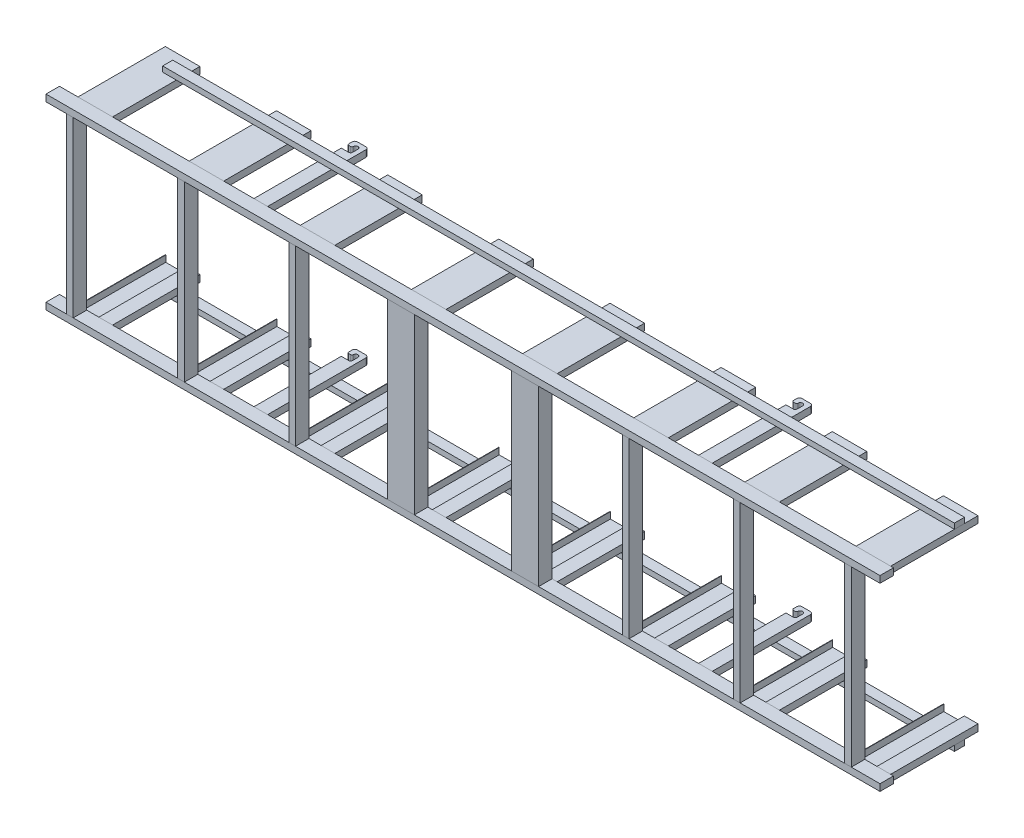
from build123d import *

# Parameters (mm, degrees)
SKETCH1_W              = 6190
SKETCH1_H              = 50
BOSS_EXTRUDE1_DEPTH    = 100
BOSS_EXTRUDE1_2_DEPTH  = 100
SKETCH2_W              = 200
SKETCH2_H              = 100
BOSS_EXTRUDE2_DEPTH    = 1388
BOSS_EXTRUDE2_2_DEPTH  = 1388
BOSS_EXTRUDE3_REACH    = 6335.746
SKETCH4_W              = 50
SKETCH4_H              = 100
BOSS_EXTRUDE4_DEPTH    = 648.4
BOSS_EXTRUDE4_2_DEPTH  = 648.4
BOSS_EXTRUDE4_3_DEPTH  = 648.4
BOSS_EXTRUDE4_4_DEPTH  = 648.4
BOSS_EXTRUDE4_5_DEPTH  = 648.4
BOSS_EXTRUDE4_6_DEPTH  = 648.4
BOSS_EXTRUDE4_7_DEPTH  = 648.4
BOSS_EXTRUDE4_8_DEPTH  = 648.4
BOSS_EXTRUDE4_9_DEPTH  = 648.4
BOSS_EXTRUDE4_10_DEPTH = 648.4
BOSS_EXTRUDE4_11_DEPTH = 648.4
BOSS_EXTRUDE4_12_DEPTH = 648.4
BOSS_EXTRUDE4_13_DEPTH = 648.4
BOSS_EXTRUDE4_14_DEPTH = 648.4
BOSS_EXTRUDE4_15_DEPTH = 648.4
BOSS_EXTRUDE4_16_DEPTH = 648.4
BOSS_EXTRUDE5_DEPTH    = 50
BOSS_EXTRUDE5_2_DEPTH  = 50
BOSS_EXTRUDE6_DEPTH    = 50
BOSS_EXTRUDE6_2_DEPTH  = 50
SKETCH10_W             = 75
SKETCH10_H             = 40
BOSS_EXTRUDE7_DEPTH    = 5876.6
BOSS_EXTRUDE7_2_DEPTH  = 5876.6


with BuildPart() as part:
    # Sketch1 → Boss-Extrude1 (new body)
    with BuildSketch(Plane.XY):
        with Locations((3095, 1363)):
            Rectangle(SKETCH1_W, SKETCH1_H)
    extrude(amount=BOSS_EXTRUDE1_DEPTH)


with BuildPart() as body_2:
    # Sketch1 → Boss-Extrude1 2 (new body)
    with BuildSketch(Plane.XY):
        with Locations((3095, 25)):
            Rectangle(SKETCH1_W, SKETCH1_H)
    extrude(amount=BOSS_EXTRUDE1_2_DEPTH)


with BuildPart() as body_3:
    # Sketch2 → Boss-Extrude2 (new body)
    with BuildSketch(Plane.XZ):
        with Locations((2634, 50)):
            Rectangle(SKETCH2_W, SKETCH2_H)
    extrude(amount=-BOSS_EXTRUDE2_DEPTH)


with BuildPart() as body_4:
    # Sketch2 → Boss-Extrude2 2 (new body)
    with BuildSketch(Plane.XZ):
        with Locations((3556, 50)):
            Rectangle(SKETCH2_W, SKETCH2_H)
    extrude(amount=-BOSS_EXTRUDE2_2_DEPTH)


with BuildPart() as body_5:

    # Sketch4 → Boss-Extrude3 (new, up to next)
    with BuildSketch(Plane(origin=(0, 50, 0), x_dir=(1, 0, 0), z_dir=(0, 1, 0)), mode=Mode.PRIVATE) as boss_extrude3_sk1:
        with Locations((177, -50)):
            Rectangle(SKETCH4_W, SKETCH4_H)
    boss_extrude3_tool1 = extrude(boss_extrude3_sk1.sketch, amount=BOSS_EXTRUDE3_REACH, mode=Mode.PRIVATE) - part.part
    # Sketch4 → Boss-Extrude3 (new, up to next)
    with BuildSketch(Plane(origin=(0, 50, 0), x_dir=(1, 0, 0), z_dir=(0, 1, 0)), mode=Mode.PRIVATE) as boss_extrude3_sk2:
        with Locations((1002, -50)):
            Rectangle(SKETCH4_W, SKETCH4_H)
    boss_extrude3_tool2 = extrude(boss_extrude3_sk2.sketch, amount=BOSS_EXTRUDE3_REACH, mode=Mode.PRIVATE) - part.part
    # Sketch4 → Boss-Extrude3 (new, up to next)
    with BuildSketch(Plane(origin=(0, 50, 0), x_dir=(1, 0, 0), z_dir=(0, 1, 0)), mode=Mode.PRIVATE) as boss_extrude3_sk3:
        with Locations((1827, -50)):
            Rectangle(SKETCH4_W, SKETCH4_H)
    boss_extrude3_tool3 = extrude(boss_extrude3_sk3.sketch, amount=BOSS_EXTRUDE3_REACH, mode=Mode.PRIVATE) - part.part
    # Sketch4 → Boss-Extrude3 (new, up to next)
    with BuildSketch(Plane(origin=(0, 50, 0), x_dir=(1, 0, 0), z_dir=(0, 1, 0)), mode=Mode.PRIVATE) as boss_extrude3_sk4:
        with Locations((4302, -50)):
            Rectangle(SKETCH4_W, SKETCH4_H)
    boss_extrude3_tool4 = extrude(boss_extrude3_sk4.sketch, amount=BOSS_EXTRUDE3_REACH, mode=Mode.PRIVATE) - part.part
    # Sketch4 → Boss-Extrude3 (new, up to next)
    with BuildSketch(Plane(origin=(0, 50, 0), x_dir=(1, 0, 0), z_dir=(0, 1, 0)), mode=Mode.PRIVATE) as boss_extrude3_sk5:
        with Locations((5127, -50)):
            Rectangle(SKETCH4_W, SKETCH4_H)
    boss_extrude3_tool5 = extrude(boss_extrude3_sk5.sketch, amount=BOSS_EXTRUDE3_REACH, mode=Mode.PRIVATE) - part.part
    # Sketch4 → Boss-Extrude3 (new, up to next)
    with BuildSketch(Plane(origin=(0, 50, 0), x_dir=(1, 0, 0), z_dir=(0, 1, 0)), mode=Mode.PRIVATE) as boss_extrude3_sk6:
        with Locations((5952, -50)):
            Rectangle(SKETCH4_W, SKETCH4_H)
    boss_extrude3_tool6 = extrude(boss_extrude3_sk6.sketch, amount=BOSS_EXTRUDE3_REACH, mode=Mode.PRIVATE) - part.part
    add(boss_extrude3_tool1.solids().sort_by_distance((177, 50, 50))[0])
    add(boss_extrude3_tool2.solids().sort_by_distance((1002, 50, 50))[0])
    add(boss_extrude3_tool3.solids().sort_by_distance((1827, 50, 50))[0])
    add(boss_extrude3_tool4.solids().sort_by_distance((4302, 50, 50))[0])
    add(boss_extrude3_tool5.solids().sort_by_distance((5127, 50, 50))[0])
    add(boss_extrude3_tool6.solids().sort_by_distance((5952, 50, 50))[0])


with BuildPart() as body_6:
    # Sketch5 → Boss-Extrude4 (new body)
    with BuildSketch(Plane.XY):
        Polygon((137.4, 1388), (137.4, 1338), (140.4, 1338), (140.4, 1385.8), (292.4, 1385.8), (292.4, 1338), (394, 1338), (394, 1388), align=None)
    extrude(amount=-BOSS_EXTRUDE4_DEPTH)


with BuildPart() as body_7:
    # Sketch5 → Boss-Extrude4 2 (new body)
    with BuildSketch(Plane.XY):
        Polygon((962.4, 1388), (962.4, 1338), (965.4, 1338), (965.4, 1385.8), (1117.4, 1385.8), (1117.4, 1338), (1219, 1338), (1219, 1388), align=None)
    extrude(amount=-BOSS_EXTRUDE4_2_DEPTH)


with BuildPart() as body_8:
    # Sketch5 → Boss-Extrude4 3 (new body)
    with BuildSketch(Plane.XY):
        Polygon((1787.4, 1388), (1787.4, 1338), (1790.4, 1338), (1790.4, 1385.8), (1942.4, 1385.8), (1942.4, 1338), (2044, 1338), (2044, 1388), align=None)
    extrude(amount=-BOSS_EXTRUDE4_3_DEPTH)


with BuildPart() as body_9:
    # Sketch5 → Boss-Extrude4 4 (new body)
    with BuildSketch(Plane.XY):
        Polygon((2612.4, 1388), (2612.4, 1338), (2615.4, 1338), (2615.4, 1385.8), (2767.4, 1385.8), (2767.4, 1338), (2869, 1338), (2869, 1388), align=None)
    extrude(amount=-BOSS_EXTRUDE4_4_DEPTH)


with BuildPart() as body_10:
    # Sketch5 → Boss-Extrude4 5 (new body)
    with BuildSketch(Plane.XY):
        Polygon((3437.4, 1388), (3437.4, 1338), (3440.4, 1338), (3440.4, 1385.8), (3592.4, 1385.8), (3592.4, 1338), (3694, 1338), (3694, 1388), align=None)
    extrude(amount=-BOSS_EXTRUDE4_5_DEPTH)


with BuildPart() as body_11:
    # Sketch5 → Boss-Extrude4 6 (new body)
    with BuildSketch(Plane.XY):
        Polygon((4262.4, 1388), (4262.4, 1338), (4265.4, 1338), (4265.4, 1385.8), (4417.4, 1385.8), (4417.4, 1338), (4519, 1338), (4519, 1388), align=None)
    extrude(amount=-BOSS_EXTRUDE4_6_DEPTH)


with BuildPart() as body_12:
    # Sketch5 → Boss-Extrude4 7 (new body)
    with BuildSketch(Plane.XY):
        Polygon((5087.4, 1388), (5087.4, 1338), (5090.4, 1338), (5090.4, 1385.8), (5242.4, 1385.8), (5242.4, 1338), (5344, 1338), (5344, 1388), align=None)
    extrude(amount=-BOSS_EXTRUDE4_7_DEPTH)


with BuildPart() as body_13:
    # Sketch5 → Boss-Extrude4 8 (new body)
    with BuildSketch(Plane.XY):
        Polygon((5912.4, 1388), (5912.4, 1338), (5915.4, 1338), (5915.4, 1385.8), (6067.4, 1385.8), (6067.4, 1338), (6169, 1338), (6169, 1388), align=None)
    extrude(amount=-BOSS_EXTRUDE4_8_DEPTH)


with BuildPart() as body_14:
    # Sketch5 → Boss-Extrude4 9 (new body)
    with BuildSketch(Plane.XY):
        Polygon((6067.4, 2.2), (6067.4, 50), (6169, 50), (6169, 0), (5912.4, 0), (5912.4, 50), (5915.4, 50), (5915.4, 2.2), align=None)
    extrude(amount=-BOSS_EXTRUDE4_9_DEPTH)


with BuildPart() as body_15:
    # Sketch5 → Boss-Extrude4 10 (new body)
    with BuildSketch(Plane.XY):
        Polygon((5242.4, 2.2), (5242.4, 50), (5344, 50), (5344, 0), (5087.4, 0), (5087.4, 50), (5090.4, 50), (5090.4, 2.2), align=None)
    extrude(amount=-BOSS_EXTRUDE4_10_DEPTH)


with BuildPart() as body_16:
    # Sketch5 → Boss-Extrude4 11 (new body)
    with BuildSketch(Plane.XY):
        Polygon((4417.4, 2.2), (4417.4, 50), (4519, 50), (4519, 0), (4262.4, 0), (4262.4, 50), (4265.4, 50), (4265.4, 2.2), align=None)
    extrude(amount=-BOSS_EXTRUDE4_11_DEPTH)


with BuildPart() as body_17:
    # Sketch5 → Boss-Extrude4 12 (new body)
    with BuildSketch(Plane.XY):
        Polygon((3592.4, 2.2), (3592.4, 50), (3694, 50), (3694, 0), (3437.4, 0), (3437.4, 50), (3440.4, 50), (3440.4, 2.2), align=None)
    extrude(amount=-BOSS_EXTRUDE4_12_DEPTH)


with BuildPart() as body_18:
    # Sketch5 → Boss-Extrude4 13 (new body)
    with BuildSketch(Plane.XY):
        Polygon((2767.4, 2.2), (2767.4, 50), (2869, 50), (2869, 0), (2612.4, 0), (2612.4, 50), (2615.4, 50), (2615.4, 2.2), align=None)
    extrude(amount=-BOSS_EXTRUDE4_13_DEPTH)


with BuildPart() as body_19:
    # Sketch5 → Boss-Extrude4 14 (new body)
    with BuildSketch(Plane.XY):
        Polygon((1942.4, 2.2), (1942.4, 50), (2044, 50), (2044, 0), (1787.4, 0), (1787.4, 50), (1790.4, 50), (1790.4, 2.2), align=None)
    extrude(amount=-BOSS_EXTRUDE4_14_DEPTH)


with BuildPart() as body_20:
    # Sketch5 → Boss-Extrude4 15 (new body)
    with BuildSketch(Plane.XY):
        Polygon((1117.4, 2.2), (1117.4, 50), (1219, 50), (1219, 0), (962.4, 0), (962.4, 50), (965.4, 50), (965.4, 2.2), align=None)
    extrude(amount=-BOSS_EXTRUDE4_15_DEPTH)


with BuildPart() as body_21:
    # Sketch5 → Boss-Extrude4 16 (new body)
    with BuildSketch(Plane.XY):
        Polygon((292.4, 2.2), (292.4, 50), (394, 50), (394, 0), (137.4, 0), (137.4, 50), (140.4, 50), (140.4, 2.2), align=None)
    extrude(amount=-BOSS_EXTRUDE4_16_DEPTH)


with BuildPart() as body_22:
    # Sketch8 → Boss-Extrude5 (new body)
    with BuildSketch(Plane(origin=(0, 50, 0), x_dir=(1, 0, 0), z_dir=(0, 1, 0))):
        with BuildLine():
            Line((1443.4, 648.4), (1497.5, 648.4))
            ThreePointArc((1497.5, 648.4), (1508.106601718, 652.793398282), (1512.5, 663.4))
            Line((1512.5, 663.4), (1512.5, 703.4))
            ThreePointArc((1512.5, 703.4), (1495, 720.9), (1477.5, 703.4))
            ThreePointArc((1477.5, 703.4), (1474.571067812, 696.328932188), (1467.5, 693.4))
            Line((1467.5, 693.4), (1453.4, 693.4))
            ThreePointArc((1453.4, 693.4), (1446.328932188, 696.328932188), (1443.4, 703.4))
            Line((1443.4, 703.4), (1443.4, 728.4))
            ThreePointArc((1443.4, 728.4), (1449.257864376, 742.542135624), (1463.4, 748.4))
            Line((1463.4, 748.4), (1525, 748.4))
            ThreePointArc((1525, 748.4), (1539.142135624, 742.542135624), (1545, 728.4))
            Line((1545, 728.4), (1545, 0))
            Line((1545, 0), (1443.4, 0))
            Line((1443.4, 0), (1443.4, 648.4))
        make_face()
    extrude(amount=-BOSS_EXTRUDE5_DEPTH)


with BuildPart() as body_23:
    # Sketch8 → Boss-Extrude5 2 (new body)
    with BuildSketch(Plane(origin=(0, 50, 0), x_dir=(1, 0, 0), z_dir=(0, 1, 0))):
        with BuildLine():
            Line((4845, 0), (4743.4, 0))
            Line((4743.4, 0), (4743.4, 648.4))
            Line((4743.4, 648.4), (4797.5, 648.4))
            ThreePointArc((4797.5, 648.4), (4808.106601718, 652.793398282), (4812.5, 663.4))
            Line((4812.5, 663.4), (4812.5, 703.4))
            ThreePointArc((4812.5, 703.4), (4795, 720.9), (4777.5, 703.4))
            ThreePointArc((4777.5, 703.4), (4774.571067812, 696.328932188), (4767.5, 693.4))
            Line((4767.5, 693.4), (4753.4, 693.4))
            ThreePointArc((4753.4, 693.4), (4746.328932188, 696.328932188), (4743.4, 703.4))
            Line((4743.4, 703.4), (4743.4, 728.4))
            ThreePointArc((4743.4, 728.4), (4749.257864376, 742.542135624), (4763.4, 748.4))
            Line((4763.4, 748.4), (4825, 748.4))
            ThreePointArc((4825, 748.4), (4839.142135624, 742.542135624), (4845, 728.4))
            Line((4845, 728.4), (4845, 0))
        make_face()
    extrude(amount=-BOSS_EXTRUDE5_2_DEPTH)


with BuildPart() as body_24:
    # Sketch9 → Boss-Extrude6 (new body)
    with BuildSketch(Plane(origin=(0, 1388, 0), x_dir=(1, 0, 0), z_dir=(0, 1, 0))):
        with BuildLine():
            Line((1443.4, 648.4), (1497.5, 648.4))
            ThreePointArc((1497.5, 648.4), (1508.106601718, 652.793398282), (1512.5, 663.4))
            Line((1512.5, 663.4), (1512.5, 703.4))
            ThreePointArc((1512.5, 703.4), (1495, 720.9), (1477.5, 703.4))
            ThreePointArc((1477.5, 703.4), (1474.571067812, 696.328932188), (1467.5, 693.4))
            Line((1467.5, 693.4), (1453.4, 693.4))
            ThreePointArc((1453.4, 693.4), (1446.328932188, 696.328932188), (1443.4, 703.4))
            Line((1443.4, 703.4), (1443.4, 728.4))
            ThreePointArc((1443.4, 728.4), (1449.257864376, 742.542135624), (1463.4, 748.4))
            Line((1463.4, 748.4), (1525, 748.4))
            ThreePointArc((1525, 748.4), (1539.142135624, 742.542135624), (1545, 728.4))
            Line((1545, 728.4), (1545, 0))
            Line((1545, 0), (1443.4, 0))
            Line((1443.4, 0), (1443.4, 648.4))
        make_face()
    extrude(amount=-BOSS_EXTRUDE6_DEPTH)


with BuildPart() as body_25:
    # Sketch9 → Boss-Extrude6 2 (new body)
    with BuildSketch(Plane(origin=(0, 1388, 0), x_dir=(1, 0, 0), z_dir=(0, 1, 0))):
        with BuildLine():
            Line((4845, 0), (4743.4, 0))
            Line((4743.4, 0), (4743.4, 648.4))
            Line((4743.4, 648.4), (4797.5, 648.4))
            ThreePointArc((4797.5, 648.4), (4808.106601718, 652.793398282), (4812.5, 663.4))
            Line((4812.5, 663.4), (4812.5, 703.4))
            ThreePointArc((4812.5, 703.4), (4795, 720.9), (4777.5, 703.4))
            ThreePointArc((4777.5, 703.4), (4774.571067812, 696.328932188), (4767.5, 693.4))
            Line((4767.5, 693.4), (4753.4, 693.4))
            ThreePointArc((4753.4, 693.4), (4746.328932188, 696.328932188), (4743.4, 703.4))
            Line((4743.4, 703.4), (4743.4, 728.4))
            ThreePointArc((4743.4, 728.4), (4749.257864376, 742.542135624), (4763.4, 748.4))
            Line((4763.4, 748.4), (4825, 748.4))
            ThreePointArc((4825, 748.4), (4839.142135624, 742.542135624), (4845, 728.4))
            Line((4845, 728.4), (4845, 0))
        make_face()
    extrude(amount=-BOSS_EXTRUDE6_2_DEPTH)


with BuildPart() as body_26:
    # Sketch10 → Boss-Extrude7 (new body)
    with BuildSketch(Plane(origin=(6169, 0, 0), x_dir=(0, 0, -1), z_dir=(1, 0, 0))):
        with Locations((510.9, -20)):
            Rectangle(SKETCH10_W, SKETCH10_H)
    extrude(amount=-BOSS_EXTRUDE7_DEPTH)


with BuildPart() as body_27:
    # Sketch10 → Boss-Extrude7 2 (new body)
    with BuildSketch(Plane(origin=(6169, 0, 0), x_dir=(0, 0, -1), z_dir=(1, 0, 0))):
        with Locations((510.9, 1408)):
            Rectangle(SKETCH10_W, SKETCH10_H)
    extrude(amount=-BOSS_EXTRUDE7_2_DEPTH)


solid = Compound([part.part, body_2.part, body_3.part, body_4.part, body_5.part, body_6.part, body_7.part, body_8.part, body_9.part, body_10.part, body_11.part, body_12.part, body_13.part, body_14.part, body_15.part, body_16.part, body_17.part, body_18.part, body_19.part, body_20.part, body_21.part, body_22.part, body_23.part, body_24.part, body_25.part, body_26.part, body_27.part])
